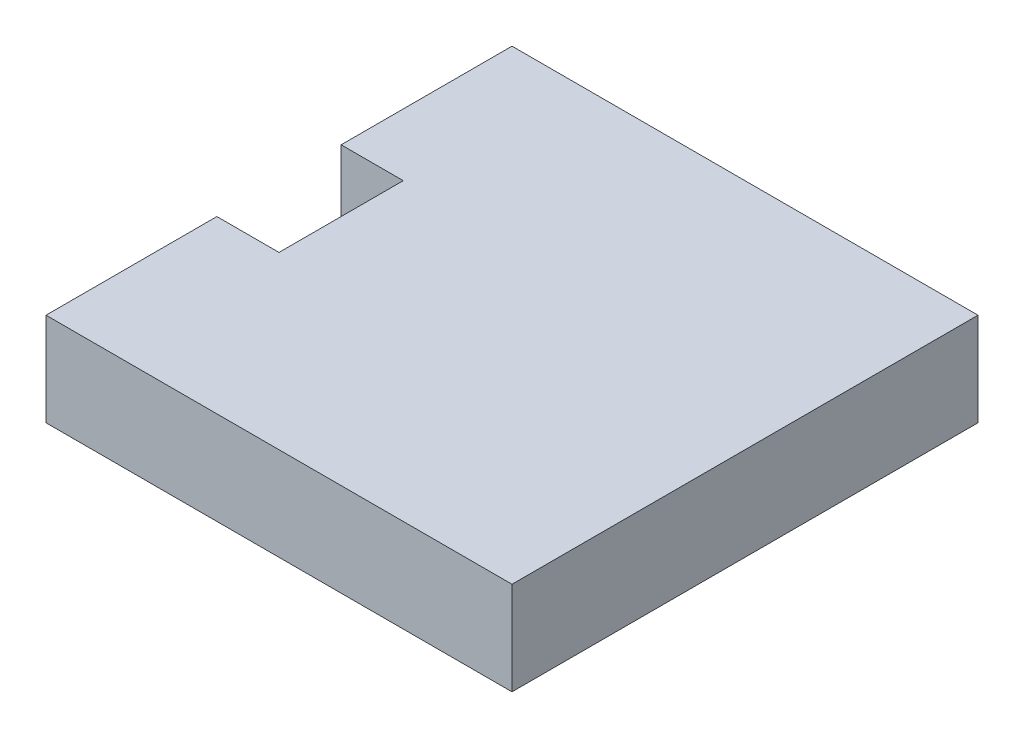
from build123d import *

# Parameters (mm, degrees)
BOSS_EXTRUDE1_DEPTH = 0.3


with BuildPart() as part:
    # Sketch1 → Boss-Extrude1 (new body)
    with BuildSketch(Plane(origin=(0, 0, 0), x_dir=(1, 0, 0), z_dir=(0, 1, 0))):
        Polygon((0, 1.5), (-1.5, 1.5), (-1.5, 0.95), (-1.3, 0.95), (-1.3, 0.55), (-1.5, 0.55), (-1.5, 0), (0, 0), align=None)
    extrude(amount=BOSS_EXTRUDE1_DEPTH)


solid = part.part
